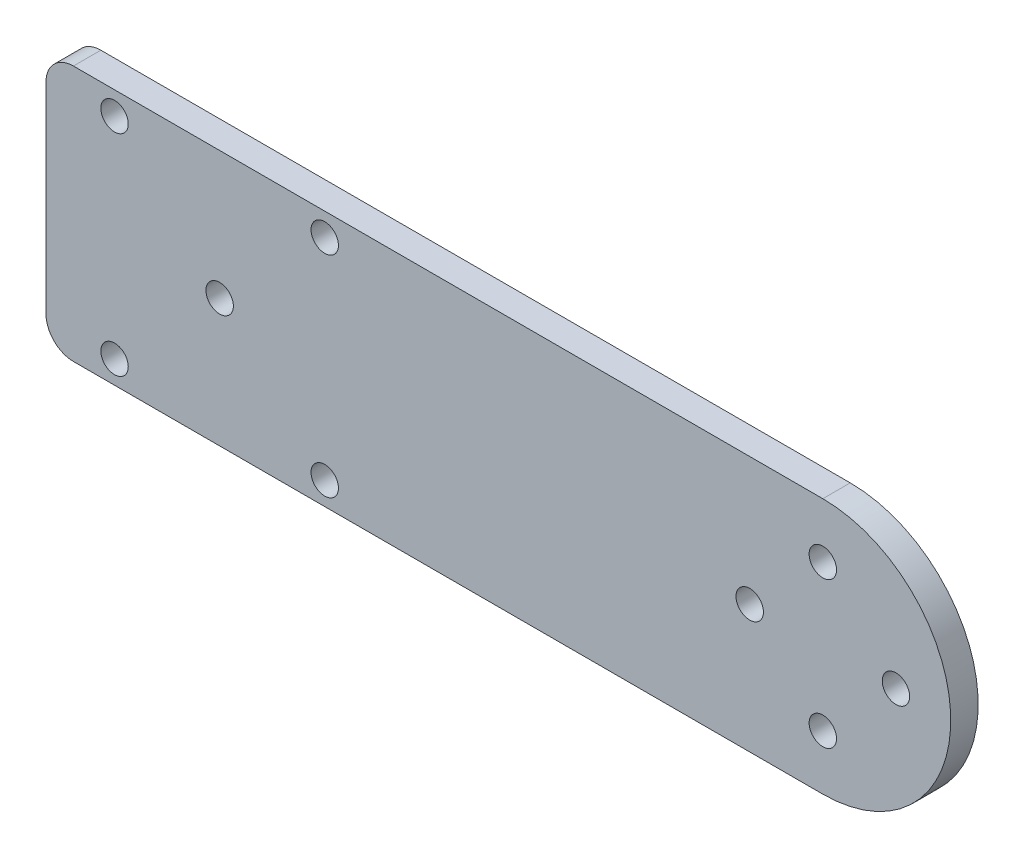
from build123d import *

# Parameters (mm, degrees)
SKETCH_1_R      = 1.5
EXTRUDE_1_DEPTH = 3
FILLET_1_R      = 3


with BuildPart() as part:
    # 草图1 → 凸台-拉伸1 (new body)
    with BuildSketch(Plane.XY):
        with BuildLine():
            Line((-85, -14), (0, -14))
            ThreePointArc((0, -14), (14, 0), (0, 14))
            Line((0, 14), (-85, 14))
            Line((-85, 14), (-85, -14))
        make_face()
        with Locations((-54.5, -11.5)):
            Circle(SKETCH_1_R, mode=Mode.SUBTRACT)
        with Locations((-77.5, -11.5)):
            Circle(SKETCH_1_R, mode=Mode.SUBTRACT)
        with Locations((-66, 0)):
            Circle(SKETCH_1_R, mode=Mode.SUBTRACT)
        with Locations((0, -8)):
            Circle(SKETCH_1_R, mode=Mode.SUBTRACT)
        with Locations((8, 0)):
            Circle(SKETCH_1_R, mode=Mode.SUBTRACT)
        with Locations((-77.5, 11.5)):
            Circle(SKETCH_1_R, mode=Mode.SUBTRACT)
        with Locations((-54.5, 11.5)):
            Circle(SKETCH_1_R, mode=Mode.SUBTRACT)
        with Locations((-8, 0)):
            Circle(SKETCH_1_R, mode=Mode.SUBTRACT)
        with Locations((0, 8)):
            Circle(SKETCH_1_R, mode=Mode.SUBTRACT)
    extrude(amount=EXTRUDE_1_DEPTH)

    # 圆角1
    fillet_1_edges = [part.edges().sort_by_distance(p)[0] for p in [
        (-85, 14, 1.5),
        (-85, -14, 1.5),
    ]]
    fillet(fillet_1_edges, radius=FILLET_1_R)


solid = part.part
